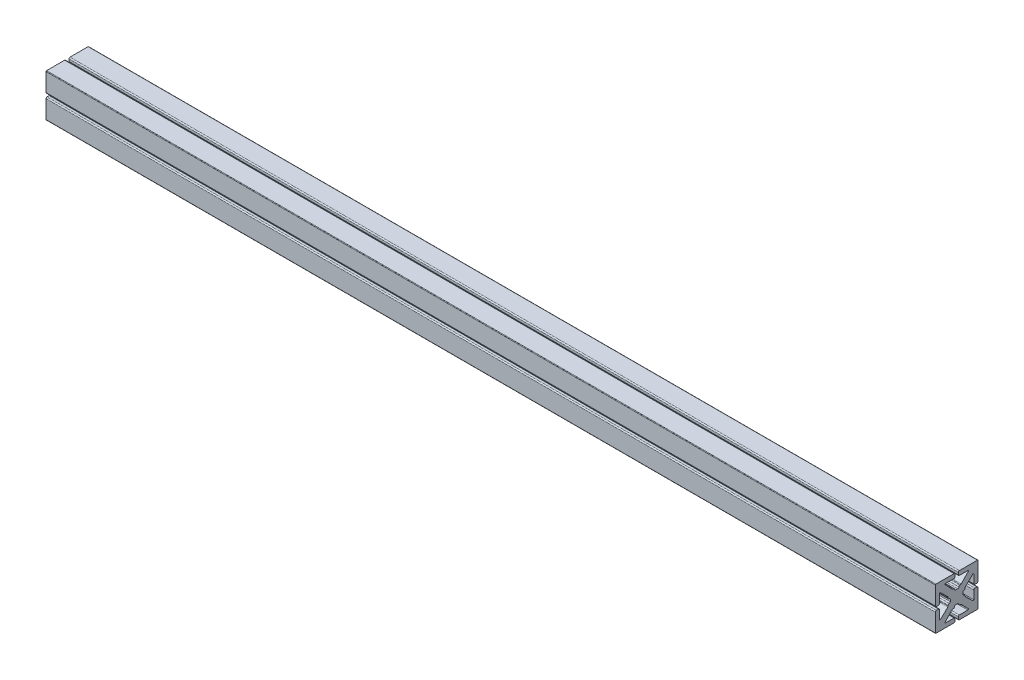
from build123d import *

# Parameters (mm, degrees)
BOSS_EXTRUDE1_DEPTH = 2.54
SCALE1_SCALE        = 8
BOSS_EXTRUDE2_DEPTH = 835


with BuildPart() as part:
    # Sketch1 → Boss-Extrude1 (new body)
    with BuildSketch(Plane(origin=(0, 0, 0), x_dir=(0, 0, -1), z_dir=(1, 0, 0))):
        with BuildLine():
            Line((-0.2413, 1.4986), (0.2413, 1.4986))
            ThreePointArc((0.2413, 1.4986), (0.420905122, 1.572994878), (0.4953, 1.7526))
            ThreePointArc((0.4953, 1.7526), (0.569694878, 1.932205122), (0.7493, 2.0066))
            Line((0.7493, 2.0066), (0.882498635, 2.0066))
            ThreePointArc((0.882498635, 2.0066), (0.981966313, 2.026886113), (1.065545703, 2.084504086))
            Line((1.065545703, 2.084504086), (2.714118421, 3.798152043))
            ThreePointArc((2.714118421, 3.798152043), (2.739451831, 3.935933839), (2.622594887, 4.0132))
            Line((2.622594887, 4.0132), (0.635, 4.0132))
            ThreePointArc((0.635, 4.0132), (0.455394878, 4.087594878), (0.381, 4.2672))
            Line((0.381, 4.2672), (0.381, 4.7498))
            ThreePointArc((0.381, 4.7498), (0.455394878, 4.929405122), (0.635, 5.0038))
            Line((0.635, 5.0038), (4.8768, 5.0038))
            ThreePointArc((4.8768, 5.0038), (4.966602561, 4.966602561), (5.0038, 4.8768))
            Line((5.0038, 4.8768), (5.0038, 0.635))
            ThreePointArc((5.0038, 0.635), (4.929405122, 0.455394878), (4.7498, 0.381))
            Line((4.7498, 0.381), (4.2672, 0.381))
            ThreePointArc((4.2672, 0.381), (4.087594878, 0.455394878), (4.0132, 0.635))
            Line((4.0132, 0.635), (4.0132, 2.622594887))
            ThreePointArc((4.0132, 2.622594887), (3.935933839, 2.739451831), (3.798152043, 2.714118421))
            Line((3.798152043, 2.714118421), (2.084504086, 1.065545703))
            ThreePointArc((2.084504086, 1.065545703), (2.026886113, 0.981966313), (2.0066, 0.882498635))
            Line((2.0066, 0.882498635), (2.0066, 0.7493))
            ThreePointArc((2.0066, 0.7493), (1.932205122, 0.569694878), (1.7526, 0.4953))
            ThreePointArc((1.7526, 0.4953), (1.572994878, 0.420905122), (1.4986, 0.2413))
            Line((1.4986, 0.2413), (1.4986, -0.2413))
            ThreePointArc((1.4986, -0.2413), (1.572994878, -0.420905122), (1.7526, -0.4953))
            ThreePointArc((1.7526, -0.4953), (1.932205122, -0.569694878), (2.0066, -0.7493))
            Line((2.0066, -0.7493), (2.0066, -0.882498635))
            ThreePointArc((2.0066, -0.882498635), (2.026886113, -0.981966313), (2.084504086, -1.065545703))
            Line((2.084504086, -1.065545703), (3.798152043, -2.714118421))
            ThreePointArc((3.798152043, -2.714118421), (3.935933839, -2.739451831), (4.0132, -2.622594887))
            Line((4.0132, -2.622594887), (4.0132, -0.635))
            ThreePointArc((4.0132, -0.635), (4.087594878, -0.455394878), (4.2672, -0.381))
            Line((4.2672, -0.381), (4.7498, -0.381))
            ThreePointArc((4.7498, -0.381), (4.929405122, -0.455394878), (5.0038, -0.635))
            Line((5.0038, -0.635), (5.0038, -4.8768))
            ThreePointArc((5.0038, -4.8768), (4.966602561, -4.966602561), (4.8768, -5.0038))
            Line((4.8768, -5.0038), (0.635, -5.0038))
            ThreePointArc((0.635, -5.0038), (0.455394878, -4.929405122), (0.381, -4.7498))
            Line((0.381, -4.7498), (0.381, -4.2672))
            ThreePointArc((0.381, -4.2672), (0.455394878, -4.087594878), (0.635, -4.0132))
            Line((0.635, -4.0132), (2.622594887, -4.0132))
            ThreePointArc((2.622594887, -4.0132), (2.739451831, -3.935933839), (2.714118421, -3.798152043))
            Line((2.714118421, -3.798152043), (1.065545703, -2.084504086))
            ThreePointArc((1.065545703, -2.084504086), (0.981966313, -2.026886113), (0.882498635, -2.0066))
            Line((0.882498635, -2.0066), (0.7493, -2.0066))
            ThreePointArc((0.7493, -2.0066), (0.569694878, -1.932205122), (0.4953, -1.7526))
            ThreePointArc((0.4953, -1.7526), (0.420905122, -1.572994878), (0.2413, -1.4986))
            Line((0.2413, -1.4986), (-0.2413, -1.4986))
            ThreePointArc((-0.2413, -1.4986), (-0.420905122, -1.572994878), (-0.4953, -1.7526))
            ThreePointArc((-0.4953, -1.7526), (-0.569694878, -1.932205122), (-0.7493, -2.0066))
            Line((-0.7493, -2.0066), (-0.882498635, -2.0066))
            ThreePointArc((-0.882498635, -2.0066), (-0.981966313, -2.026886113), (-1.065545703, -2.084504086))
            Line((-1.065545703, -2.084504086), (-2.714118421, -3.798152043))
            ThreePointArc((-2.714118421, -3.798152043), (-2.739451831, -3.935933839), (-2.622594887, -4.0132))
            Line((-2.622594887, -4.0132), (-0.635, -4.0132))
            ThreePointArc((-0.635, -4.0132), (-0.455394878, -4.087594878), (-0.381, -4.2672))
            Line((-0.381, -4.2672), (-0.381, -4.7498))
            ThreePointArc((-0.381, -4.7498), (-0.455394878, -4.929405122), (-0.635, -5.0038))
            Line((-0.635, -5.0038), (-4.8768, -5.0038))
            ThreePointArc((-4.8768, -5.0038), (-4.966602561, -4.966602561), (-5.0038, -4.8768))
            Line((-5.0038, -4.8768), (-5.0038, -0.635))
            ThreePointArc((-5.0038, -0.635), (-4.929405122, -0.455394878), (-4.7498, -0.381))
            Line((-4.7498, -0.381), (-4.2672, -0.381))
            ThreePointArc((-4.2672, -0.381), (-4.087594878, -0.455394878), (-4.0132, -0.635))
            Line((-4.0132, -0.635), (-4.0132, -2.622594887))
            ThreePointArc((-4.0132, -2.622594887), (-3.935933839, -2.739451831), (-3.798152043, -2.714118421))
            Line((-3.798152043, -2.714118421), (-2.084504086, -1.065545703))
            ThreePointArc((-2.084504086, -1.065545703), (-2.026886113, -0.981966313), (-2.0066, -0.882498635))
            Line((-2.0066, -0.882498635), (-2.0066, -0.7493))
            ThreePointArc((-2.0066, -0.7493), (-1.932205122, -0.569694878), (-1.7526, -0.4953))
            ThreePointArc((-1.7526, -0.4953), (-1.572994878, -0.420905122), (-1.4986, -0.2413))
            Line((-1.4986, -0.2413), (-1.4986, 0.2413))
            ThreePointArc((-1.4986, 0.2413), (-1.572994878, 0.420905122), (-1.7526, 0.4953))
            ThreePointArc((-1.7526, 0.4953), (-1.932205122, 0.569694878), (-2.0066, 0.7493))
            Line((-2.0066, 0.7493), (-2.0066, 0.882498635))
            ThreePointArc((-2.0066, 0.882498635), (-2.026886113, 0.981966313), (-2.084504086, 1.065545703))
            Line((-2.084504086, 1.065545703), (-3.798152043, 2.714118421))
            ThreePointArc((-3.798152043, 2.714118421), (-3.935933839, 2.739451831), (-4.0132, 2.622594887))
            Line((-4.0132, 2.622594887), (-4.0132, 0.635))
            ThreePointArc((-4.0132, 0.635), (-4.087594878, 0.455394878), (-4.2672, 0.381))
            Line((-4.2672, 0.381), (-4.7498, 0.381))
            ThreePointArc((-4.7498, 0.381), (-4.929405122, 0.455394878), (-5.0038, 0.635))
            Line((-5.0038, 0.635), (-5.0038, 4.8768))
            ThreePointArc((-5.0038, 4.8768), (-4.966602561, 4.966602561), (-4.8768, 5.0038))
            Line((-4.8768, 5.0038), (-0.635, 5.0038))
            ThreePointArc((-0.635, 5.0038), (-0.455394878, 4.929405122), (-0.381, 4.7498))
            Line((-0.381, 4.7498), (-0.381, 4.2672))
            ThreePointArc((-0.381, 4.2672), (-0.455394878, 4.087594878), (-0.635, 4.0132))
            Line((-0.635, 4.0132), (-2.622594887, 4.0132))
            ThreePointArc((-2.622594887, 4.0132), (-2.739451831, 3.935933839), (-2.714118421, 3.798152043))
            Line((-2.714118421, 3.798152043), (-1.065545703, 2.084504086))
            ThreePointArc((-1.065545703, 2.084504086), (-0.981966313, 2.026886113), (-0.882498635, 2.0066))
            Line((-0.882498635, 2.0066), (-0.7493, 2.0066))
            ThreePointArc((-0.7493, 2.0066), (-0.569694878, 1.932205122), (-0.4953, 1.7526))
            ThreePointArc((-0.4953, 1.7526), (-0.420905122, 1.572994878), (-0.2413, 1.4986))
        make_face()
    extrude(amount=BOSS_EXTRUDE1_DEPTH)


with BuildPart() as part_1:
    # Scale1: scaled about (1.27, 0, 0)
    add(part.part.scale(SCALE1_SCALE).moved(Location((-8.89, 0, 0))))

    # Sketch2 → Boss-Extrude2 (add, symmetric)
    with BuildSketch(Plane(origin=(0, 0, 0), x_dir=(0, 0, -1), z_dir=(1, 0, 0))):
        with BuildLine():
            Line((-37.9984, 3.048), (-34.1376, 3.048))
            ThreePointArc((-34.1376, 3.048), (-32.700759021, 3.643159021), (-32.1056, 5.08))
            Line((-32.1056, 5.08), (-32.1056, 20.980759097))
            ThreePointArc((-32.1056, 20.980759097), (-31.487470712, 21.915614646), (-30.385216345, 21.71294737))
            Line((-30.385216345, 21.71294737), (-16.67603269, 8.524365626))
            ThreePointArc((-16.67603269, 8.524365626), (-16.215088903, 7.855730504), (-16.0528, 7.059989081))
            Line((-16.0528, 7.059989081), (-16.0528, 5.9944))
            ThreePointArc((-16.0528, 5.9944), (-15.457640979, 4.557559021), (-14.0208, 3.9624))
            ThreePointArc((-14.0208, 3.9624), (-12.583959021, 3.367240979), (-11.9888, 1.9304))
            Line((-11.9888, 1.9304), (-11.9888, -1.9304))
            ThreePointArc((-11.9888, -1.9304), (-12.583959021, -3.367240979), (-14.0208, -3.9624))
            ThreePointArc((-14.0208, -3.9624), (-15.457640979, -4.557559021), (-16.0528, -5.9944))
            Line((-16.0528, -5.9944), (-16.0528, -7.059989081))
            ThreePointArc((-16.0528, -7.059989081), (-16.215088903, -7.855730504), (-16.67603269, -8.524365626))
            Line((-16.67603269, -8.524365626), (-30.385216345, -21.71294737))
            ThreePointArc((-30.385216345, -21.71294737), (-31.487470712, -21.915614646), (-32.1056, -20.980759097))
            Line((-32.1056, -20.980759097), (-32.1056, -5.08))
            ThreePointArc((-32.1056, -5.08), (-32.700759021, -3.643159021), (-34.1376, -3.048))
            Line((-34.1376, -3.048), (-37.9984, -3.048))
            ThreePointArc((-37.9984, -3.048), (-39.435240979, -3.643159021), (-40.0304, -5.08))
            Line((-40.0304, -5.08), (-40.0304, -39.0144))
            ThreePointArc((-40.0304, -39.0144), (-39.73282049, -39.73282049), (-39.0144, -40.0304))
            Line((-39.0144, -40.0304), (-5.08, -40.0304))
            ThreePointArc((-5.08, -40.0304), (-3.643159021, -39.435240979), (-3.048, -37.9984))
            Line((-3.048, -37.9984), (-3.048, -34.1376))
            ThreePointArc((-3.048, -34.1376), (-3.643159021, -32.700759021), (-5.08, -32.1056))
            Line((-5.08, -32.1056), (-20.980759097, -32.1056))
            ThreePointArc((-20.980759097, -32.1056), (-21.915614646, -31.487470712), (-21.71294737, -30.385216345))
            Line((-21.71294737, -30.385216345), (-8.524365626, -16.67603269))
            ThreePointArc((-8.524365626, -16.67603269), (-7.855730504, -16.215088903), (-7.059989081, -16.0528))
            Line((-7.059989081, -16.0528), (-5.9944, -16.0528))
            ThreePointArc((-5.9944, -16.0528), (-4.557559021, -15.457640979), (-3.9624, -14.0208))
            ThreePointArc((-3.9624, -14.0208), (-3.367240979, -12.583959021), (-1.9304, -11.9888))
            Line((-1.9304, -11.9888), (1.9304, -11.9888))
            ThreePointArc((1.9304, -11.9888), (3.367240979, -12.583959021), (3.9624, -14.0208))
            ThreePointArc((3.9624, -14.0208), (4.557559021, -15.457640979), (5.9944, -16.0528))
            Line((5.9944, -16.0528), (7.059989081, -16.0528))
            ThreePointArc((7.059989081, -16.0528), (7.855730504, -16.215088903), (8.524365626, -16.67603269))
            Line((8.524365626, -16.67603269), (21.71294737, -30.385216345))
            ThreePointArc((21.71294737, -30.385216345), (21.915614646, -31.487470712), (20.980759097, -32.1056))
            Line((20.980759097, -32.1056), (5.08, -32.1056))
            ThreePointArc((5.08, -32.1056), (3.643159021, -32.700759021), (3.048, -34.1376))
            Line((3.048, -34.1376), (3.048, -37.9984))
            ThreePointArc((3.048, -37.9984), (3.643159021, -39.435240979), (5.08, -40.0304))
            Line((5.08, -40.0304), (39.0144, -40.0304))
            ThreePointArc((39.0144, -40.0304), (39.73282049, -39.73282049), (40.0304, -39.0144))
            Line((40.0304, -39.0144), (40.0304, -5.08))
            ThreePointArc((40.0304, -5.08), (39.435240979, -3.643159021), (37.9984, -3.048))
            Line((37.9984, -3.048), (34.1376, -3.048))
            ThreePointArc((34.1376, -3.048), (32.700759021, -3.643159021), (32.1056, -5.08))
            Line((32.1056, -5.08), (32.1056, -20.980759097))
            ThreePointArc((32.1056, -20.980759097), (31.487470712, -21.915614646), (30.385216345, -21.71294737))
            Line((30.385216345, -21.71294737), (16.67603269, -8.524365626))
            ThreePointArc((16.67603269, -8.524365626), (16.215088903, -7.855730504), (16.0528, -7.059989081))
            Line((16.0528, -7.059989081), (16.0528, -5.9944))
            ThreePointArc((16.0528, -5.9944), (15.457640979, -4.557559021), (14.0208, -3.9624))
            ThreePointArc((14.0208, -3.9624), (12.583959021, -3.367240979), (11.9888, -1.9304))
            Line((11.9888, -1.9304), (11.9888, 1.9304))
            ThreePointArc((11.9888, 1.9304), (12.583959021, 3.367240979), (14.0208, 3.9624))
            ThreePointArc((14.0208, 3.9624), (15.457640979, 4.557559021), (16.0528, 5.9944))
            Line((16.0528, 5.9944), (16.0528, 7.059989081))
            ThreePointArc((16.0528, 7.059989081), (16.215088903, 7.855730504), (16.67603269, 8.524365626))
            Line((16.67603269, 8.524365626), (30.385216345, 21.71294737))
            ThreePointArc((30.385216345, 21.71294737), (31.487470712, 21.915614646), (32.1056, 20.980759097))
            Line((32.1056, 20.980759097), (32.1056, 5.08))
            ThreePointArc((32.1056, 5.08), (32.700759021, 3.643159021), (34.1376, 3.048))
            Line((34.1376, 3.048), (37.9984, 3.048))
            ThreePointArc((37.9984, 3.048), (39.435240979, 3.643159021), (40.0304, 5.08))
            Line((40.0304, 5.08), (40.0304, 39.0144))
            ThreePointArc((40.0304, 39.0144), (39.73282049, 39.73282049), (39.0144, 40.0304))
            Line((39.0144, 40.0304), (5.08, 40.0304))
            ThreePointArc((5.08, 40.0304), (3.643159021, 39.435240979), (3.048, 37.9984))
            Line((3.048, 37.9984), (3.048, 34.1376))
            ThreePointArc((3.048, 34.1376), (3.643159021, 32.700759021), (5.08, 32.1056))
            Line((5.08, 32.1056), (20.980759097, 32.1056))
            ThreePointArc((20.980759097, 32.1056), (21.915614646, 31.487470712), (21.71294737, 30.385216345))
            Line((21.71294737, 30.385216345), (8.524365626, 16.67603269))
            ThreePointArc((8.524365626, 16.67603269), (7.855730504, 16.215088903), (7.059989081, 16.0528))
            Line((7.059989081, 16.0528), (5.9944, 16.0528))
            ThreePointArc((5.9944, 16.0528), (4.557559021, 15.457640979), (3.9624, 14.0208))
            ThreePointArc((3.9624, 14.0208), (3.367240979, 12.583959021), (1.9304, 11.9888))
            Line((1.9304, 11.9888), (-1.9304, 11.9888))
            ThreePointArc((-1.9304, 11.9888), (-3.367240979, 12.583959021), (-3.9624, 14.0208))
            ThreePointArc((-3.9624, 14.0208), (-4.557559021, 15.457640979), (-5.9944, 16.0528))
            Line((-5.9944, 16.0528), (-7.059989081, 16.0528))
            ThreePointArc((-7.059989081, 16.0528), (-7.855730504, 16.215088903), (-8.524365626, 16.67603269))
            Line((-8.524365626, 16.67603269), (-21.71294737, 30.385216345))
            ThreePointArc((-21.71294737, 30.385216345), (-21.915614646, 31.487470712), (-20.980759097, 32.1056))
            Line((-20.980759097, 32.1056), (-5.08, 32.1056))
            ThreePointArc((-5.08, 32.1056), (-3.643159021, 32.700759021), (-3.048, 34.1376))
            Line((-3.048, 34.1376), (-3.048, 37.9984))
            ThreePointArc((-3.048, 37.9984), (-3.643159021, 39.435240979), (-5.08, 40.0304))
            Line((-5.08, 40.0304), (-39.0144, 40.0304))
            ThreePointArc((-39.0144, 40.0304), (-39.73282049, 39.73282049), (-40.0304, 39.0144))
            Line((-40.0304, 39.0144), (-40.0304, 5.08))
            ThreePointArc((-40.0304, 5.08), (-39.435240979, 3.643159021), (-37.9984, 3.048))
        make_face()
    extrude(amount=BOSS_EXTRUDE2_DEPTH, both=True)


solid = part_1.part
